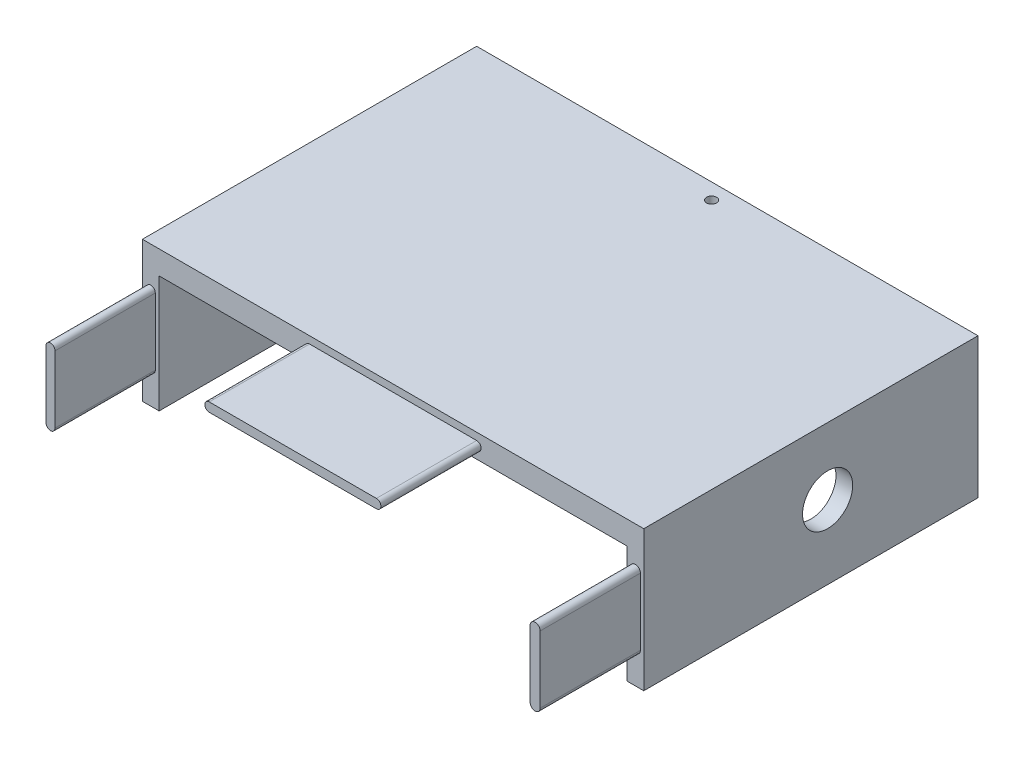
from build123d import *

# Parameters (mm, degrees)
BOSS_EXTRUDE2_DEPTH = 100
BOSS_EXTRUDE3_DEPTH = 30
SKETCH10_R          = 7.5
CUT_EXTRUDE2_DEPTH  = 210
SKETCH15_R          = 1.5
CUT_EXTRUDE3_DEPTH  = 10
SKETCH16_W          = 24
SKETCH16_H          = 12
BOSS_EXTRUDE5_DEPTH = 2
SKETCH17_W          = 3
SKETCH17_H          = 12
BOSS_EXTRUDE6_DEPTH = 25
SKETCH19_R          = 3.5
CUT_EXTRUDE4_DEPTH  = 1
SKETCH20_R          = 1.55
CUT_EXTRUDE5_DEPTH  = 3
SKETCH21_W          = 45
SKETCH21_H          = 1.5
BOSS_EXTRUDE7_DEPTH = 35
SKETCH23_R          = 8.25
CUT_EXTRUDE6_DEPTH  = 40
CUT_EXTRUDE7_DEPTH  = 40


with BuildPart() as part:
    # Sketch3 → Boss-Extrude2 (new body)
    with BuildSketch(Plane.XY):
        Polygon((-106.54853621, -30.277349769), (-106.54853621, 11.722650231), (43.45146379, 11.722650231), (43.45146379, -30.277349769), (38.45146379, -30.277349769), (38.45146379, 4.722650231), (-101.54853621, 4.722650231), (-101.54853621, -30.277349769), align=None)
    extrude(amount=BOSS_EXTRUDE2_DEPTH)

    # Sketch4 → Boss-Extrude3 (add)
    with BuildSketch(Plane.XY.offset(100)):
        with BuildLine():
            Line((-102.69853621, -0.277349769), (-102.69853621, -20.277349769))
            ThreePointArc((-102.69853621, -20.277349769), (-104.04853621, -21.627349769), (-105.39853621, -20.277349769))
            Line((-105.39853621, -20.277349769), (-105.39853621, -0.277349769))
            ThreePointArc((-105.39853621, -0.277349769), (-104.04853621, 1.072650231), (-102.69853621, -0.277349769))
        make_face()
        with BuildLine():
            Line((-56.54853621, 9.572650231), (-6.54853621, 9.572650231))
            ThreePointArc((-6.54853621, 9.572650231), (-5.19853621, 8.222650231), (-6.54853621, 6.872650231))
            Line((-6.54853621, 6.872650231), (-56.54853621, 6.872650231))
            ThreePointArc((-56.54853621, 6.872650231), (-57.89853621, 8.222650231), (-56.54853621, 9.572650231))
        make_face()
        with BuildLine():
            Line((42.45146379, -0.277349769), (42.45146379, -20.277349769))
            ThreePointArc((42.45146379, -20.277349769), (40.95146379, -21.777349769), (39.45146379, -20.277349769))
            Line((39.45146379, -20.277349769), (39.45146379, -0.277349769))
            ThreePointArc((39.45146379, -0.277349769), (40.95146379, 1.222650231), (42.45146379, -0.277349769))
        make_face()
    extrude(amount=BOSS_EXTRUDE3_DEPTH)

    # Sketch10 → Cut-Extrude2 (cut)
    with BuildSketch(Plane(origin=(43.45146379, 0, 0), x_dir=(0, 0, -1), z_dir=(1, 0, 0))):
        with Locations((-45, -8.277349769)):
            Circle(SKETCH10_R)
    extrude(amount=-CUT_EXTRUDE2_DEPTH, mode=Mode.SUBTRACT)

    # Sketch15 → Cut-Extrude3 (cut)
    with BuildSketch(Plane(origin=(0, 11.722650231, 0), x_dir=(1, 0, 0), z_dir=(0, 1, 0))):
        with Locations(Location((-31.54853621, -4.714245873, 0), (0, 0, 270))):
            Circle(SKETCH15_R)
    extrude(amount=-CUT_EXTRUDE3_DEPTH, mode=Mode.SUBTRACT)

    # Sketch16 → Boss-Extrude5 (add)
    with BuildSketch(Plane.XZ.offset(-4.722650231)):
        with Locations((26.45146379, 69)):
            Rectangle(SKETCH16_W, SKETCH16_H)
    boss_extrude5 = extrude(amount=BOSS_EXTRUDE5_DEPTH)

    # Sketch17 → Boss-Extrude6 (add)
    with BuildSketch(Plane(origin=(0, 2.722650231, 0), x_dir=(-1, 0, 0), z_dir=(0, -1, 0))):
        with Locations((-15.95146379, -69)):
            Rectangle(SKETCH17_W, SKETCH17_H)
    boss_extrude6 = extrude(amount=BOSS_EXTRUDE6_DEPTH)

    # Sketch19 → Cut-Extrude4 (cut)
    with BuildSketch(Plane.ZY.offset(-14.45146379)):
        with Locations((69.485133357, 0.222650231)):
            Circle(SKETCH19_R)
        with Locations((69.485133357, -17.777349769)):
            Circle(SKETCH19_R)
    cut_extrude4 = extrude(amount=-CUT_EXTRUDE4_DEPTH, mode=Mode.SUBTRACT)

    # Sketch20 → Cut-Extrude5 (cut)
    with BuildSketch(Plane.ZY.offset(-15.45146379)):
        with Locations((69.485133357, 0.222650231)):
            Circle(SKETCH20_R)
        with Locations((69.485133357, -17.777349769)):
            Circle(SKETCH20_R)
    cut_extrude5 = extrude(amount=-CUT_EXTRUDE5_DEPTH, mode=Mode.SUBTRACT)

    # Mirror6: Boss-Extrude5, Boss-Extrude6, Cut-Extrude4, Cut-Extrude5 across plane
    add(boss_extrude5.mirror(Plane.ZY.offset(31.54853621)))
    add(boss_extrude6.mirror(Plane.ZY.offset(31.54853621)))
    add(cut_extrude4.mirror(Plane.ZY.offset(31.54853621)), mode=Mode.SUBTRACT)
    add(cut_extrude5.mirror(Plane.ZY.offset(31.54853621)), mode=Mode.SUBTRACT)

    # Sketch21 → Boss-Extrude7 (add)
    with BuildSketch(Plane.XZ.offset(-4.722650231)):
        with Locations((-31.54853621, 0.75)):
            Rectangle(SKETCH21_W, SKETCH21_H)
    extrude(amount=BOSS_EXTRUDE7_DEPTH)

    # Sketch23 → Cut-Extrude6 (cut)
    with BuildSketch(Plane(origin=(0, 0, 0), x_dir=(-1, 0, 0), z_dir=(0, 0, -1))):
        with Locations((44.54853621, -16.277349769)):
            Circle(SKETCH23_R)
        with Locations((18.54853621, -16.277349769)):
            Circle(SKETCH23_R)
    extrude(amount=-CUT_EXTRUDE6_DEPTH, mode=Mode.SUBTRACT)

    # Sketch24 → Cut-Extrude7 (cut)
    with BuildSketch(Plane(origin=(0, 0, 0), x_dir=(-1, 0, 0), z_dir=(0, 0, -1))):
        with BuildLine():
            Line((26.54853621, -23.095326639), (36.54853621, -23.095326639))
            ThreePointArc((36.54853621, -23.095326639), (39.773941895, -26.320732325), (36.54853621, -29.54613801))
            Line((36.54853621, -29.54613801), (26.54853621, -29.54613801))
            ThreePointArc((26.54853621, -29.54613801), (23.323130524, -26.320732325), (26.54853621, -23.095326639))
        make_face()
    extrude(amount=-CUT_EXTRUDE7_DEPTH, mode=Mode.SUBTRACT)


solid = part.part
